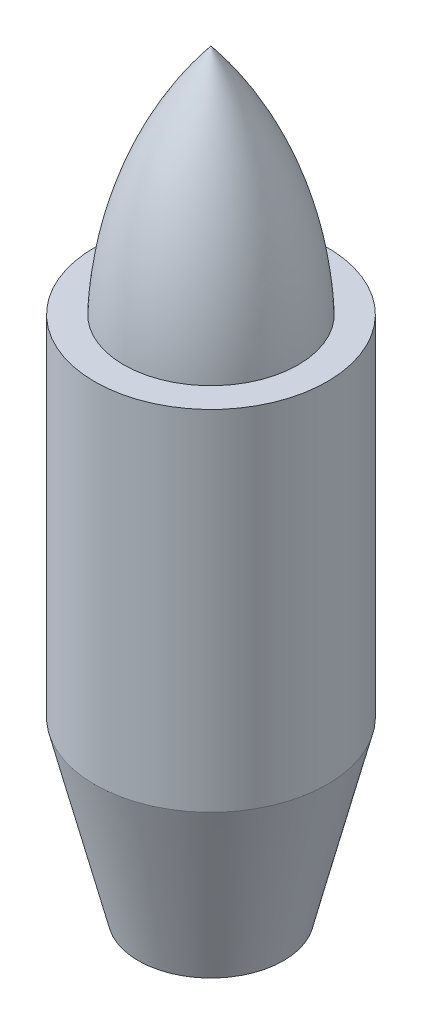
from build123d import *

# Parameters (mm, degrees)
SKETCH1_R           = 200
BOSS_EXTRUDE1_DEPTH = 600
SKETCH2_R           = 125


with BuildPart() as part:
    # Sketch1 → Boss-Extrude1 (new body)
    with BuildSketch(Plane(origin=(0, 0, 0), x_dir=(1, 0, 0), z_dir=(0, 1, 0))):
        with Locations(Location((0, 0, 0), (0, 0, 270))):
            Circle(SKETCH1_R)
    extrude(amount=BOSS_EXTRUDE1_DEPTH)

    # Sketch2 → section 0 of loft1
    with BuildSketch(Plane(origin=(0, -300, 0), x_dir=(-1, 0, 0), z_dir=(0, -1, 0)), mode=Mode.PRIVATE) as loft1_s0:
        Circle(SKETCH2_R)
    # loft up to a face of the part (loft1)
    loft([loft1_s0.sketch, Face(Wire([part.edges().sort_by_distance((-145.793725484, 0, -136.909421186))[0]]))])

    # Sketch3 → Revolve-Thin1 (revolve)
    with BuildSketch(Plane(origin=(0, 0, 0), x_dir=(0, 0, -1), z_dir=(1, 0, 0))):
        with BuildLine():
            ThreePointArc((-150, 600), (-107.313276388, 812.117478645), (0, 1000))
            Line((0, 1000), (0, 600))
            Line((0, 600), (-10, 600))
            Line((-10, 600), (-10, 970.682765056))
            ThreePointArc((-10, 970.682765056), (-102.910558319, 794.926882071), (-140.007374323, 599.616031136))
            Line((-140.007374323, 599.616031136), (-150, 600))
        make_face()
    revolve(axis=Axis((0, 1000, 0), (0, -1, 0)))


solid = part.part
